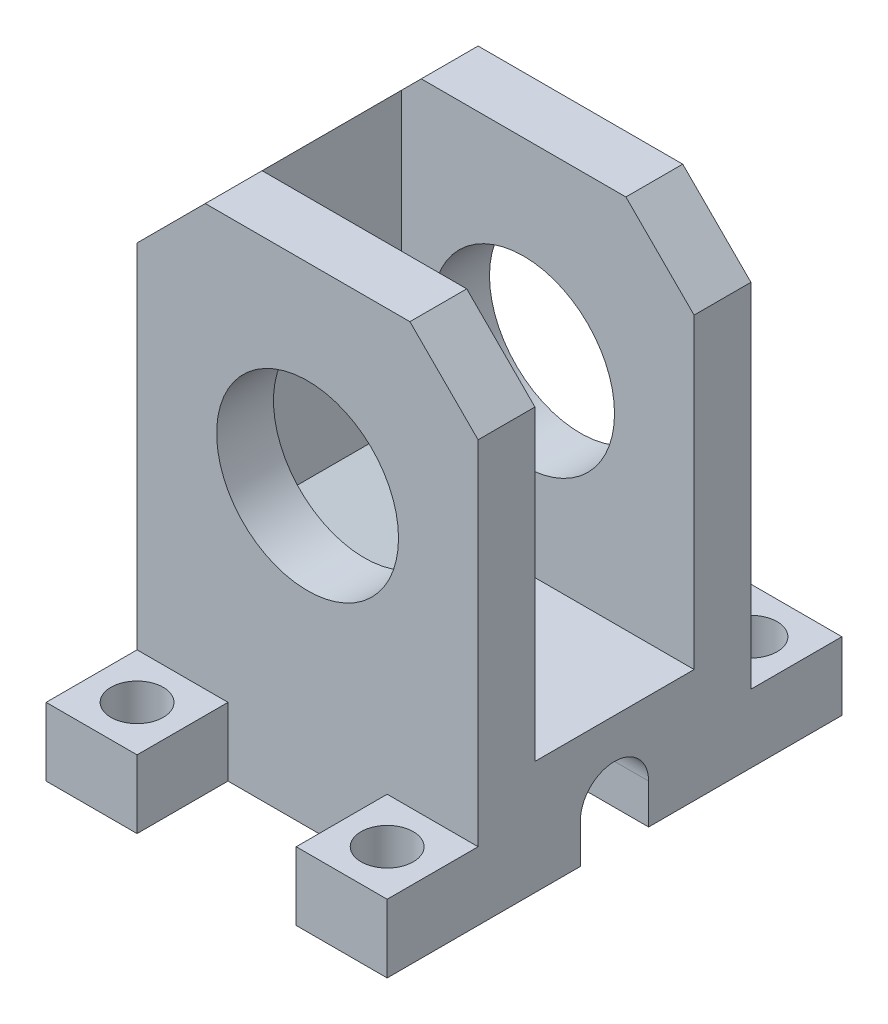
from build123d import *

# Parameters (mm, degrees)
ESQUISSE1_R             = 8
BOSS_EXTRU_1_DEPTH      = 5
ESQUISSE2_W             = 30
ESQUISSE2_H             = 12
BOSS_EXTRU_2_DEPTH      = 14
ESQUISSE4_W             = 30
ESQUISSE4_H             = 5
BOSS_EXTRU_3_DEPTH      = 45
ENL_V_START             = -10
ESQUISSE6_R             = 8
ENL_V_MAT_EXTRU_3_DEPTH = 10
ESQUISSE8_W             = 8
ESQUISSE8_H             = 8
ESQUISSE8_R             = 2.3
BOSS_EXTRU_4_DEPTH      = 8
ENL_V_MAT_EXTRU_4_DEPTH = 2
ENL_V_MAT_EXTRU_5_DEPTH = 50
ENL_V_MAT_EXTRU_6_DEPTH = 50
BOSS_EXTRU_5_DEPTH      = 14
BOSS_EXTRU_7_DEPTH      = 15


with BuildPart() as part:
    # Esquisse1 → Boss.-Extru.1 (new body)
    with BuildSketch(Plane.XY):
        Polygon((0, 0), (15, 0), (15, 45), (-15, 45), (-15, 0), align=None)
        with Locations((0, 28)):
            Circle(ESQUISSE1_R, mode=Mode.SUBTRACT)
    extrude(amount=-BOSS_EXTRU_1_DEPTH)

    # Esquisse2 → Boss.-Extru.2 (add)
    with BuildSketch(Plane(origin=(0, 0, -5), x_dir=(-1, 0, 0), z_dir=(0, 0, -1))):
        with Locations((0, 6)):
            Rectangle(ESQUISSE2_W, ESQUISSE2_H)
    extrude(amount=BOSS_EXTRU_2_DEPTH)

    # Esquisse4 → Boss.-Extru.3 (add)
    with BuildSketch(Plane.XZ):
        with Locations((0, -21.5)):
            Rectangle(ESQUISSE4_W, ESQUISSE4_H)
    extrude(amount=-BOSS_EXTRU_3_DEPTH)

    # Esquisse6 → Enlèv. mat.-Extru.3 (cut)
    with BuildSketch(Plane(origin=(0, 0, -24), x_dir=(-1, 0, 0), z_dir=(0, 0, -1)).offset(ENL_V_START)):
        with Locations(Location((0, 28, 0), (0, 0, 180))):
            Circle(ESQUISSE6_R)
    extrude(amount=ENL_V_MAT_EXTRU_3_DEPTH, mode=Mode.SUBTRACT)

    # Esquisse8 → Boss.-Extru.4 (add)
    # profile 1 of 4: a face of its own
    with BuildSketch(Plane.XZ):
        with Locations((-11, 4)):
            Rectangle(ESQUISSE8_W, ESQUISSE8_H)
        with Locations(Location((-11, 4, 0), (0, 0, 270))):
            Circle(ESQUISSE8_R, mode=Mode.SUBTRACT)
    # profile 2 of 4: a face of its own
    with BuildSketch(Plane.XZ):
        with Locations((11, 4)):
            Rectangle(ESQUISSE8_W, ESQUISSE8_H)
        with Locations(Location((11, 4, 0), (0, 0, 270))):
            Circle(ESQUISSE8_R, mode=Mode.SUBTRACT)
    # profile 3 of 4: a face of its own
    with BuildSketch(Plane.XZ):
        with Locations((-11, -28)):
            Rectangle(ESQUISSE8_W, ESQUISSE8_H)
        with Locations(Location((-11, -28, 0), (0, 0, 270))):
            Circle(ESQUISSE8_R, mode=Mode.SUBTRACT)
    # profile 4 of 4: a face of its own
    with BuildSketch(Plane.XZ):
        with Locations((11, -28)):
            Rectangle(ESQUISSE8_W, ESQUISSE8_H)
        with Locations(Location((11, -28, 0), (0, 0, 270))):
            Circle(ESQUISSE8_R, mode=Mode.SUBTRACT)
    extrude(amount=-BOSS_EXTRU_4_DEPTH)

    # Esquisse9 → Enlèv. mat.-Extru.4 (cut)
    with BuildSketch(Plane.XZ):
        Polygon((-15, 8), (-15, -32), (-7, -32), (-7, -24), (7, -24), (7, -32), (15, -32), (15, 8), (7, 8), (7, 0), (-7, 0), (-7, 8), align=None)
    extrude(amount=-ENL_V_MAT_EXTRU_4_DEPTH, mode=Mode.SUBTRACT)

    # Esquisse10 → Enlèv. mat.-Extru.5 (cut)
    with BuildSketch(Plane.ZY.offset(15)):
        with BuildLine():
            Line((-15, 2), (-9, 2))
            Line((-9, 2), (-9, 5.5))
            ThreePointArc((-9, 5.5), (-12, 8.5), (-15, 5.5))
            Line((-15, 5.5), (-15, 2))
        make_face()
    extrude(amount=-ENL_V_MAT_EXTRU_5_DEPTH, mode=Mode.SUBTRACT)

    # Esquisse11 → Enlèv. mat.-Extru.6 (cut)
    with BuildSketch(Plane.XY):
        Polygon((-9, 45), (-15, 45), (-15, 39), align=None)
        Polygon((15, 45), (9, 45), (15, 39), align=None)
    extrude(amount=-ENL_V_MAT_EXTRU_6_DEPTH, mode=Mode.SUBTRACT)

    # Esquisse12 → Boss.-Extru.5 (add)
    with BuildSketch(Plane(origin=(0, 0, -5), x_dir=(-1, 0, 0), z_dir=(0, 0, -1))):
        Polygon((0, 12), (15, 12), (15, 20), align=None)
    extrude(amount=BOSS_EXTRU_5_DEPTH)

    # Esquisse13 → Boss.-Extru.7 (add)
    with BuildSketch(Plane.XY.offset(-19)):
        Polygon((-15, 20), (-15, 39), (-10.757359313, 43.242640687), (-10.757359313, 17.084037873), align=None)
    extrude(amount=BOSS_EXTRU_7_DEPTH)


solid = part.part
